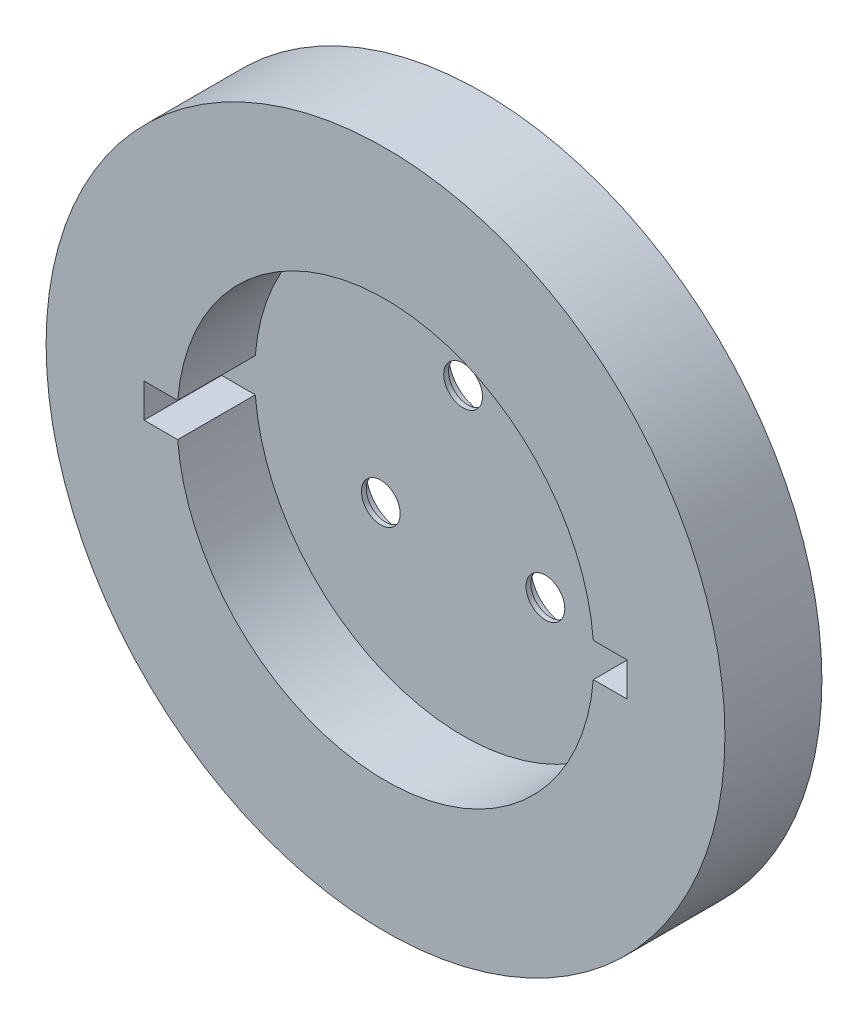
from build123d import *

# Parameters (mm, degrees)
SKETCH_1_R          = 35
EXTRUDE_1_DEPTH     = 10
CUT_EXTRUDE_1_DEPTH = 8
SKETCH_4_R          = 3.5
CUT_EXTRUDE_2_DEPTH = 1.5
SKETCH_6_R          = 2
CUT_EXTRUDE_3_DEPTH = 51.222007128


with BuildPart() as part:
    # 草图1 → 凸台-拉伸1 (new body)
    with BuildSketch(Plane.XY):
        Circle(SKETCH_1_R)
    extrude(amount=EXTRUDE_1_DEPTH)

    # 草图2 → 切除-拉伸1 (cut)
    with BuildSketch(Plane.XY.offset(10)):
        with BuildLine():
            ThreePointArc((21.428660714, 1.75), (0, 21.5), (-21.428660714, 1.75))
            Line((-21.428660714, 1.75), (-24.9, 1.75))
            Line((-24.9, 1.75), (-24.9, -1.75))
            Line((-24.9, -1.75), (-21.428660714, -1.75))
            ThreePointArc((-21.428660714, -1.75), (0, -21.5), (21.428660714, -1.75))
            Line((21.428660714, -1.75), (24.9, -1.75))
            Line((24.9, -1.75), (24.9, 1.75))
            Line((24.9, 1.75), (21.428660714, 1.75))
        make_face()
    extrude(amount=-CUT_EXTRUDE_1_DEPTH, mode=Mode.SUBTRACT)

    # 草图4 → 切除-拉伸2 (cut)
    with BuildSketch(Plane(origin=(0, 0, 0), x_dir=(-1, 0, 0), z_dir=(0, 0, -1))):
        with Locations((8.487048957, -4.9)):
            Circle(SKETCH_4_R)
        with Locations((-8.487048957, -4.9)):
            Circle(SKETCH_4_R)
        with Locations((0, 9.8)):
            Circle(SKETCH_4_R)
    extrude(amount=-CUT_EXTRUDE_2_DEPTH, mode=Mode.SUBTRACT)

    # 草图6 → 切除-拉伸3 (cut, through all)
    with BuildSketch(Plane(origin=(0, 0, 1.5), x_dir=(-1, 0, 0), z_dir=(0, 0, -1))):
        with Locations((0, 9.8)):
            Circle(SKETCH_6_R)
        with Locations((8.487048957, -4.9)):
            Circle(SKETCH_6_R)
        with Locations((-8.487048957, -4.9)):
            Circle(SKETCH_6_R)
    extrude(amount=-CUT_EXTRUDE_3_DEPTH, mode=Mode.SUBTRACT)


solid = part.part
